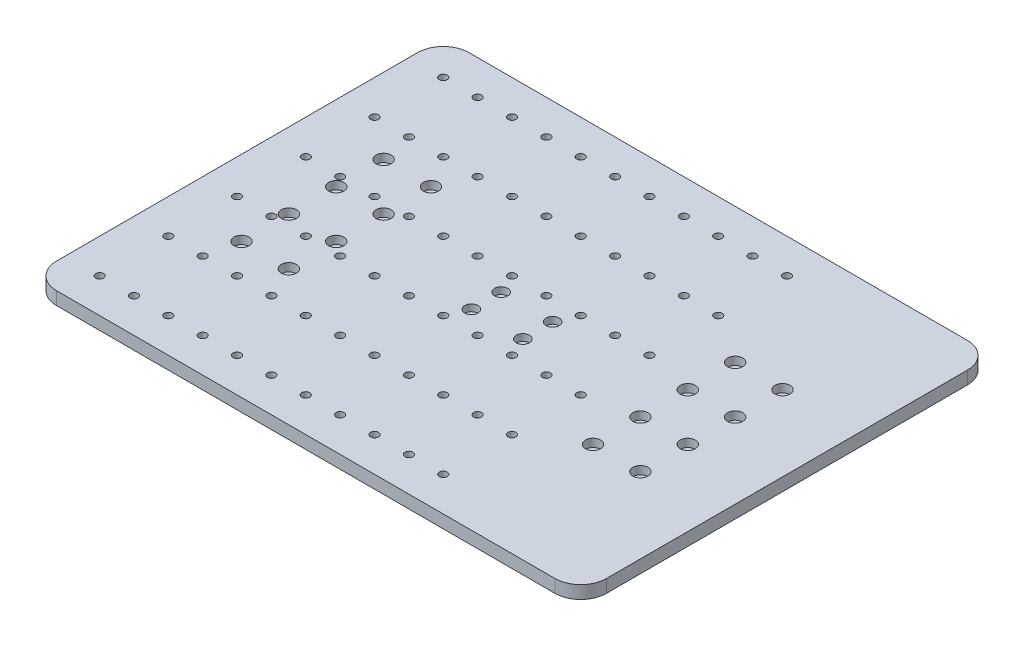
from build123d import *

# Parameters (mm, degrees)
SKETCH1_W        = 406.4
SKETCH1_H        = 304.8
EXTRUSION1_DEPTH = 9.525
FILLET1_R        = 19.05
FILLET2_R        = 19.05
FILLET3_R        = 19.05
FILLET4_R        = 19.05
HOLE1_D          = 5.842
HOLE1_DEPTH      = 25.4
HOLE1_TIP        = 1.755113868
HOLE4_D          = 5
HOLE4_DEPTH      = 25.4
HOLE4_TIP        = 1.502151548
HOLE5_D          = 4
HOLE5_DEPTH      = 25.4
HOLE5_TIP        = 1.201721238
HOLE6_D          = 11.2
HOLE6_DEPTH      = 6
HOLE7_D          = 9.75
HOLE7_DEPTH      = 5


with BuildPart() as part:
    # Sketch1 → Extrusion1 (new body)
    with BuildSketch(Plane(origin=(0, 0, 0), x_dir=(-1, 0, 0), z_dir=(0, 1, 0))):
        Rectangle(SKETCH1_W, SKETCH1_H)
    extrude(amount=EXTRUSION1_DEPTH)

    # Fillet1
    fillet1_edges = [part.edges().sort_by_distance(p)[0] for p in [
        (203.2, 4.7625, 152.4),
    ]]
    fillet(fillet1_edges, radius=FILLET1_R)

    # Fillet2
    fillet2_edges = [part.edges().sort_by_distance(p)[0] for p in [
        (203.2, 4.7625, -152.4),
    ]]
    fillet(fillet2_edges, radius=FILLET2_R)

    # Fillet3
    fillet3_edges = [part.edges().sort_by_distance(p)[0] for p in [
        (-203.2, 4.7625, 152.4),
    ]]
    fillet(fillet3_edges, radius=FILLET3_R)

    # Fillet4
    fillet4_edges = [part.edges().sort_by_distance(p)[0] for p in [
        (-203.2, 4.7625, -152.4),
    ]]
    fillet(fillet4_edges, radius=FILLET4_R)

    # Hole1
    with Locations(Plane(origin=(0, 9.525, 0), x_dir=(1, 0, 0), z_dir=(0, 1, 0))):
        with Locations((-177.8, -127), (-177.8, -76.2), (-177.8, -25.4), (-177.8, 25.4), (-177.8, 76.2), (-177.8, 127), (-152.4, -127), (-152.4, -76.2), (-152.4, -25.4), (-152.4, 25.4), (-152.4, 76.2), (-152.4, 127), (-127, -127), (-127, -76.2), (-127, -25.4), (-127, 25.4), (-127, 76.2), (-127, 127), (-101.6, -127), (-101.6, -76.2), (-101.6, -25.4), (-101.6, 25.4), (-101.6, 76.2), (-101.6, 127), (-76.2, -127), (-76.2, -76.2), (-76.2, -25.4), (-76.2, 25.4), (-76.2, 76.2), (-76.2, 127), (-50.8, -127), (-50.8, -76.2), (-50.8, -25.4), (-50.8, 25.4), (-50.8, 76.2), (-50.8, 127), (-25.4, -127), (-25.4, -76.2), (-25.4, -25.4), (-25.4, 25.4), (-25.4, 76.2), (-25.4, 127), (0, -127), (0, -76.2), (0, -25.4), (0, 25.4), (0, 76.2), (0, 127), (25.4, -127), (25.4, -76.2), (25.4, -25.4), (25.4, 25.4), (25.4, 76.2), (25.4, 127), (50.8, -127), (50.8, -76.2), (50.8, -25.4), (50.8, 25.4), (50.8, 76.2), (50.8, 127), (76.2, -127), (76.2, -76.2), (76.2, -25.4), (76.2, 25.4), (76.2, 76.2), (76.2, 127)):
            Hole(HOLE1_D / 2, depth=HOLE1_DEPTH)
            with Locations((0, 0, -(HOLE1_DEPTH + HOLE1_TIP / 2))):  # 118° drill point
                Cone(0, HOLE1_D / 2, HOLE1_TIP, mode=Mode.SUBTRACT)

    # Hole4
    with Locations(Plane(origin=(0, 9.525, 0), x_dir=(1, 0, 0), z_dir=(0, 1, 0))):
        with Locations((-147.400000005, 17.5), (-147.400000005, 52.5), (-112.400000005, 52.5), (-112.400000005, -17.5), (-112.400000005, 17.5), (-147.400000005, -17.5), (-147.400000005, -52.5), (-112.400000005, -52.5), (112.400000005, -17.5), (147.400000005, -17.5), (147.400000005, -52.5), (112.400000005, -52.5), (112.400000005, 52.5), (147.400000005, 17.5), (112.400000005, 17.5), (147.400000005, 52.5)):
            Hole(HOLE4_D / 2, depth=HOLE4_DEPTH)
            with Locations((0, 0, -(HOLE4_DEPTH + HOLE4_TIP / 2))):  # 118° drill point
                Cone(0, HOLE4_D / 2, HOLE4_TIP, mode=Mode.SUBTRACT)

    # Hole5
    with Locations(Plane(origin=(0, 9.525, 0), x_dir=(1, 0, 0), z_dir=(0, 1, 0))):
        with Locations((-19, 11), (19, 11), (-19, -11), (19, -11)):
            Hole(HOLE5_D / 2, depth=HOLE5_DEPTH)
            with Locations((0, 0, -(HOLE5_DEPTH + HOLE5_TIP / 2))):  # 118° drill point
                Cone(0, HOLE5_D / 2, HOLE5_TIP, mode=Mode.SUBTRACT)

    # Hole6
    with Locations(Plane(origin=(-147.400000005, 9.525, -52.5), x_dir=(0, 0, -1), z_dir=(0, 1, 0))):
        with Locations((0, 0), (0, -35), (-35, -35), (-35, 0), (-70, 0), (-70, -35), (-105, -35), (-105, 0), (0, -259.800000009), (0, -294.800000009), (-35, -294.800000009), (-35, -259.800000009), (-70, -259.800000009), (-70, -294.800000009), (-105, -294.800000009), (-105, -259.800000009)):
            Hole(HOLE6_D / 2, depth=HOLE6_DEPTH)

    # Hole7
    with Locations(Plane(origin=(-19, 9.525, -11), x_dir=(0, 0, -1), z_dir=(0, 1, 0))):
        with Locations((0, 0), (0, -38), (-22, -38), (-22, 0)):
            Hole(HOLE7_D / 2, depth=HOLE7_DEPTH)


solid = part.part
